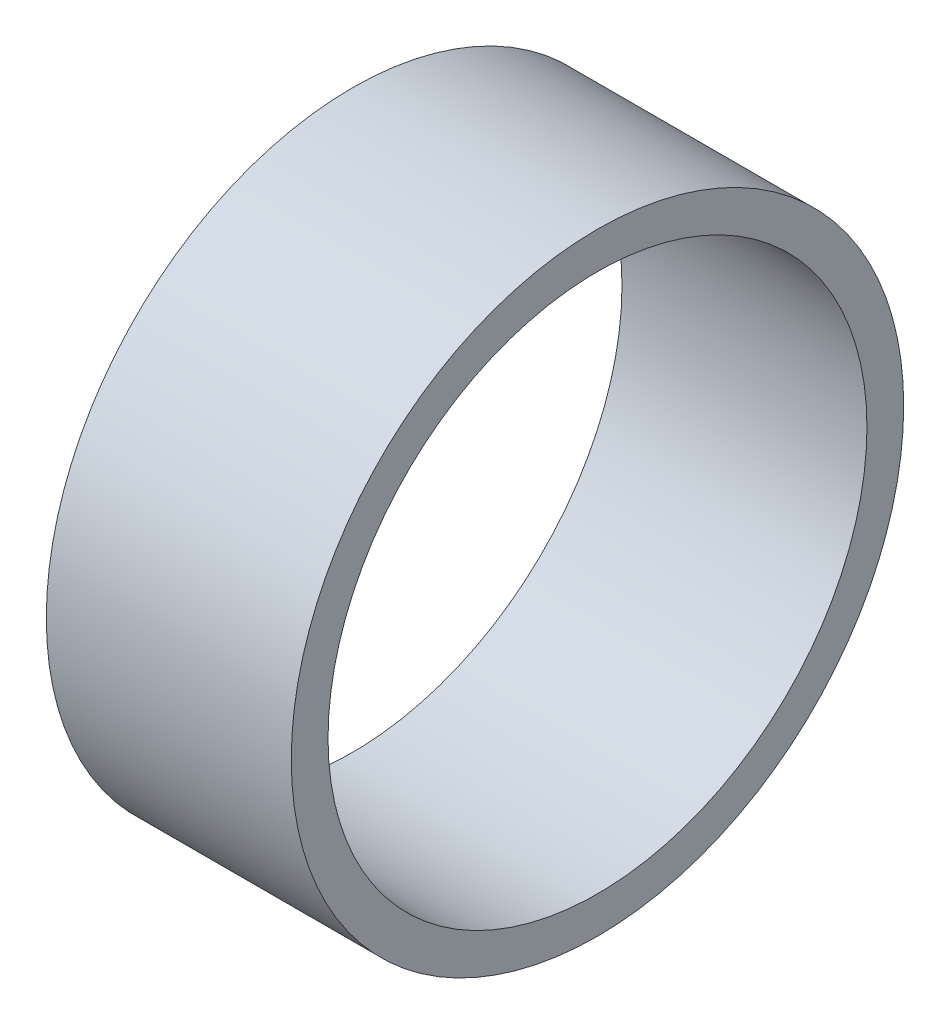
from build123d import *

# Parameters (mm, degrees)
SKETCH1_W = 40
SKETCH1_H = 6


with BuildPart() as part:
    # Sketch1 → Revolve1 (revolve)
    with BuildSketch(Plane.XY, mode=Mode.PRIVATE) as revolve1_sk:
        with Locations((0, 47)):
            Rectangle(SKETCH1_W, SKETCH1_H)
    revolve(revolve1_sk.sketch.rotate(Axis((-45.422396857, 0, 0), (1, 0, 0)), 90), axis=Axis((-45.422396857, 0, 0), (1, 0, 0)))


solid = part.part
